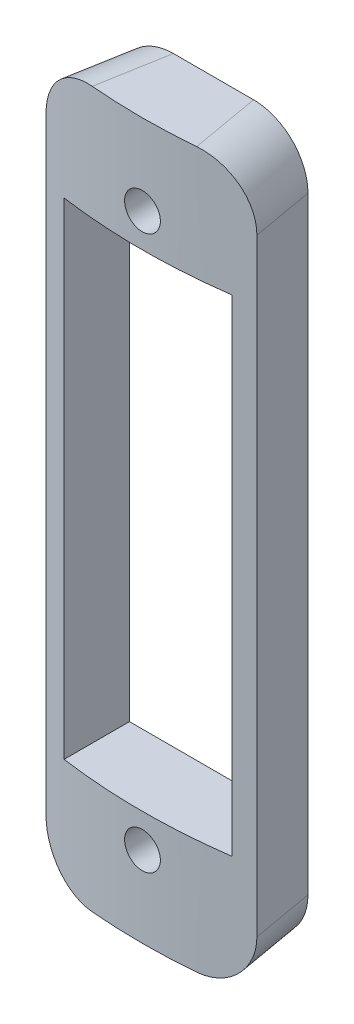
from build123d import *

# Parameters (mm, degrees)
SKETCH1_W                         = 2
SKETCH1_H                         = 40
BULK_EXTRUDE_ANGLE                = 20
CONNECTOR_PASSTHRU_DEPTH          = 41.509013499
CONNECTOR_PASSTHRU_DEPTH_BACK     = 41.509013499
SKETCH2_R                         = 1
SKETCH2_W                         = 9.4
SKETCH2_H                         = 27.2
REAR_FLATTENING_REACH             = 42.509
SKETCH3_W                         = 11.10393272
SKETCH3_H                         = 40
SKETCH3_R                         = 1
SKETCH3_W_2                       = 9.4
SKETCH3_H_2                       = 27.2
REAR_FLATTENING_DIRECTION_2_DEPTH = 1.5
SKETCH4_W                         = 5.405389312
SKETCH4_H                         = 40
CUT_EXTRUDE2_DEPTH                = 42.783584431
SKETCH5_W                         = 5.359461023
SKETCH5_H                         = 40
CUT_EXTRUDE3_DEPTH                = 42.783584431
FILLET1_R                         = 3


with BuildPart() as part:
    # Sketch1 → BULK EXTRUDE (revolve, symmetric)
    with BuildSketch(Plane(origin=(0, 0, 0), x_dir=(0, 0, -1), z_dir=(1, 0, 0))) as bulk_extrude_sk:
        with Locations((1, 20)):
            Rectangle(SKETCH1_W, SKETCH1_H)
    revolve(axis=Axis((0, 0, -33.9725), (0, 1, 0)), revolution_arc=BULK_EXTRUDE_ANGLE / 2)
    revolve(bulk_extrude_sk.sketch, axis=Axis((0, 0, -33.9725), (0, -1, 0)), revolution_arc=BULK_EXTRUDE_ANGLE / 2)

    # Sketch2 → CONNECTOR PASSTHRU (cut, two sides: drawn at the far end of the back side and taken through both)
    with BuildSketch(Plane.XY.offset(-CONNECTOR_PASSTHRU_DEPTH_BACK)):
        with Locations((0, 4.52)):
            Circle(SKETCH2_R)
        with Locations((0, 35.48)):
            Circle(SKETCH2_R)
        with Locations((0, 20)):
            Rectangle(SKETCH2_W, SKETCH2_H)
    extrude(amount=CONNECTOR_PASSTHRU_DEPTH + CONNECTOR_PASSTHRU_DEPTH_BACK, mode=Mode.SUBTRACT)

    # Sketch3 → REAR FLATTENING (add, up to next)
    with BuildSketch(Plane.XY.offset(-2.485734117), mode=Mode.PRIVATE) as rear_flattening_sk1:
        with Locations((0, 20)):
            Rectangle(SKETCH3_W, SKETCH3_H)
        with Locations((0, 4.52)):
            Circle(SKETCH3_R, mode=Mode.SUBTRACT)
        with Locations((0, 35.48)):
            Circle(SKETCH3_R, mode=Mode.SUBTRACT)
        with Locations((0, 20)):
            Rectangle(SKETCH3_W_2, SKETCH3_H_2, mode=Mode.SUBTRACT)
    rear_flattening_tool1 = extrude(rear_flattening_sk1.sketch, amount=REAR_FLATTENING_REACH, mode=Mode.PRIVATE) - part.part
    add(rear_flattening_tool1.solids().sort_by_distance((0, 0.415126, -2.485734))[0])

    # Sketch3 → REAR FLATTENING direction 2 (add)
    with BuildSketch(Plane.XY.offset(-2.485734117)):
        with Locations((0, 20)):
            Rectangle(SKETCH3_W, SKETCH3_H)
        with Locations((0, 4.52)):
            Circle(SKETCH3_R, mode=Mode.SUBTRACT)
        with Locations((0, 35.48)):
            Circle(SKETCH3_R, mode=Mode.SUBTRACT)
        with Locations((0, 20)):
            Rectangle(SKETCH3_W_2, SKETCH3_H_2, mode=Mode.SUBTRACT)
    extrude(amount=-REAR_FLATTENING_DIRECTION_2_DEPTH)

    # Sketch4 → Cut-Extrude2 (cut, through all)
    with BuildSketch(Plane(origin=(5.80963966, 0, -1.02439622), x_dir=(-0.17364817766693075, 0, -0.9848077530122081), z_dir=(0.9848077530122081, 0, -0.17364817766693075))):
        with Locations((2.186576045, 20)):
            Rectangle(SKETCH4_W, SKETCH4_H)
    extrude(amount=CUT_EXTRUDE2_DEPTH, mode=Mode.SUBTRACT)

    # Sketch5 → Cut-Extrude3 (cut, through all)
    with BuildSketch(Plane(origin=(-5.80963966, 0, -1.02439622), x_dir=(-0.17364817766693072, 0, 0.9848077530122081), z_dir=(-0.9848077530122081, 0, -0.17364817766693072))):
        with Locations((-2.163611901, 20)):
            Rectangle(SKETCH5_W, SKETCH5_H)
    extrude(amount=CUT_EXTRUDE3_DEPTH, mode=Mode.SUBTRACT)

    # Fillet1
    fillet1_edges = [part.edges().sort_by_distance(p)[0] for p in [
        (5.593369303, 40, -2.250926364),
        (5.593369303, 0, -2.250926364),
        (-5.593369303, 0, -2.250926364),
        (-5.593369303, 40, -2.250926364),
    ]]
    fillet(fillet1_edges, radius=FILLET1_R)


solid = part.part
